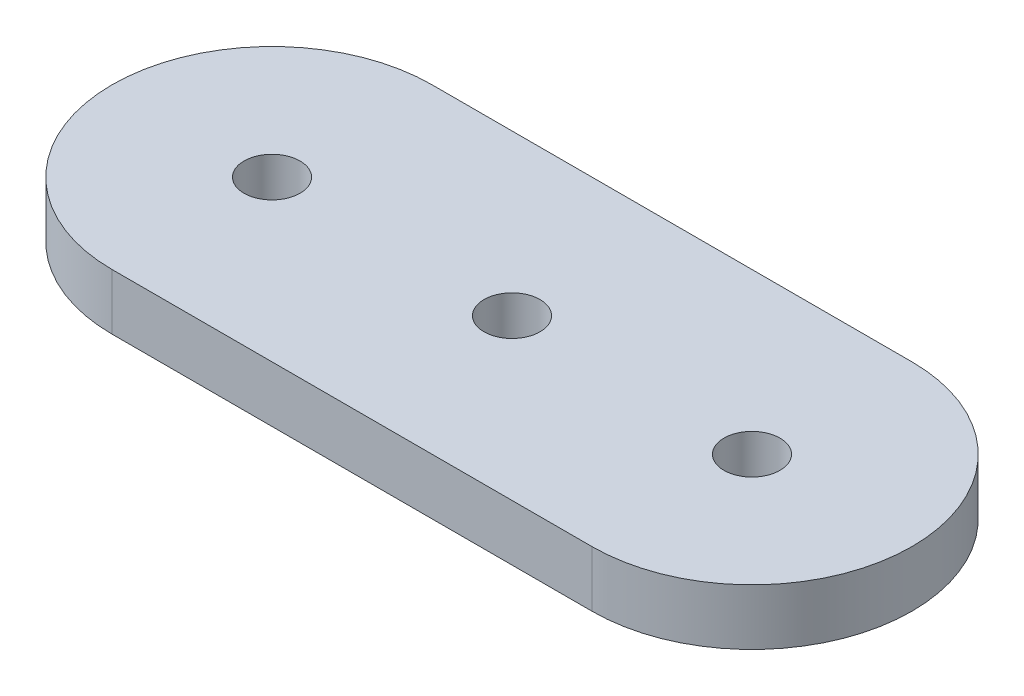
from build123d import *

# Parameters (mm, degrees)
SKETCH_1_R      = 1.75
EXTRUDE_1_DEPTH = 3.5


with BuildPart() as part:
    # Эскиз1 → Бобышка-Вытянуть1 (new body)
    with BuildSketch(Plane(origin=(0, 0, 0), x_dir=(1, 0, 0), z_dir=(0, 1, 0))):
        with BuildLine():
            Line((0, 10), (30, 10))
            ThreePointArc((30, 10), (40, 0), (30, -10))
            Line((30, -10), (0, -10))
            ThreePointArc((0, -10), (-10, 0), (0, 10))
        make_face()
        with Locations(Location((0, 0, 0), (0, 0, 270))):
            Circle(SKETCH_1_R, mode=Mode.SUBTRACT)
        with Locations(Location((30, 0, 0), (0, 0, 270))):
            Circle(SKETCH_1_R, mode=Mode.SUBTRACT)
        with Locations(Location((15, 0, 0), (0, 0, 270))):
            Circle(SKETCH_1_R, mode=Mode.SUBTRACT)
    extrude(amount=EXTRUDE_1_DEPTH)


solid = part.part
